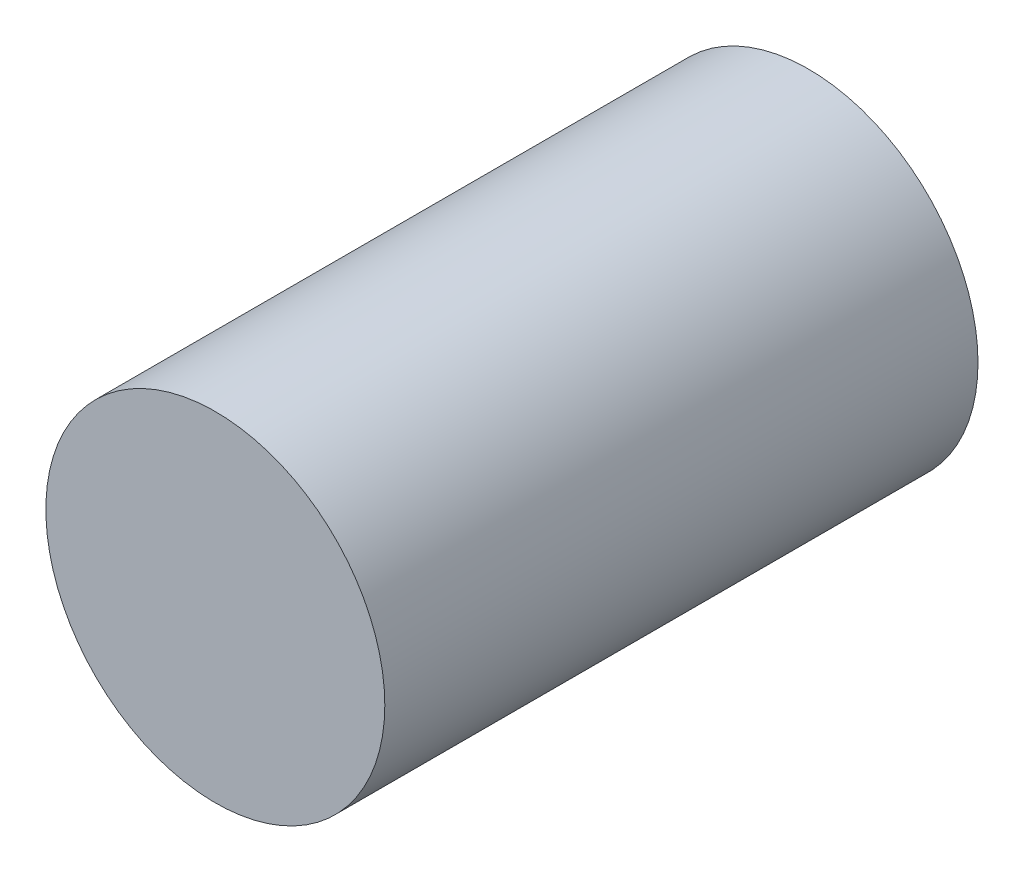
from build123d import *

# Parameters (mm, degrees)
SKETCH_1_R          = 10
EXTRUDE_1_DEPTH     = 35
SKETCH_3_R          = 9.5
CUT_EXTRUDE_1_DEPTH = 20


with BuildPart() as part:
    # 草图1 → 凸台-拉伸1 (new body)
    with BuildSketch(Plane.XY):
        Circle(SKETCH_1_R)
    extrude(amount=EXTRUDE_1_DEPTH)

    # 草图3 → 切除-拉伸1 (cut)
    with BuildSketch(Plane(origin=(0, 0, 0), x_dir=(-1, 0, 0), z_dir=(0, 0, -1))):
        Circle(SKETCH_3_R)
    extrude(amount=-CUT_EXTRUDE_1_DEPTH, mode=Mode.SUBTRACT)


solid = part.part
